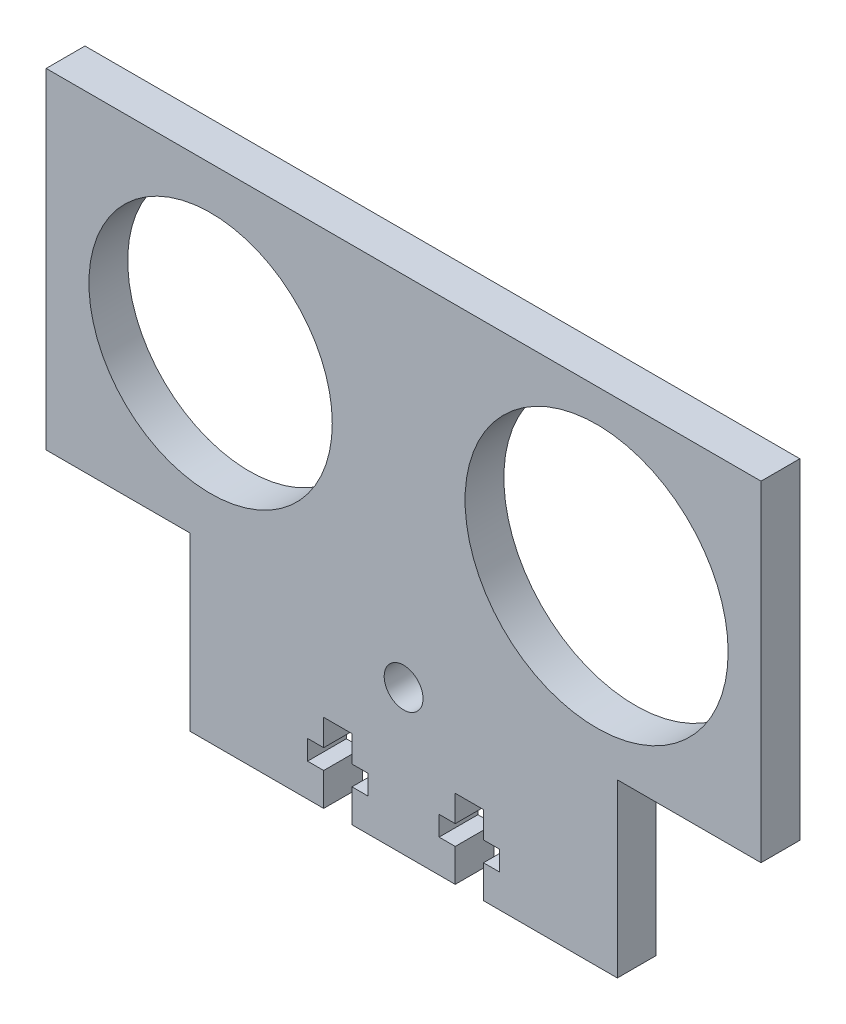
from build123d import *

# Parameters (mm, degrees)
SKETCH1_R           = 2.95
SKETCH1_R_2         = 20
SKETCH1_R_3         = 18.5
BOSS_EXTRUDE1_DEPTH = 5.9
CUT_EXTRUDE2_DEPTH  = 78.081470808


with BuildPart() as part:
    # Sketch1 → Boss-Extrude1 (new body)
    with BuildSketch(Plane.XY):
        Polygon((-32.5, 4.1), (-32.5, -22), (32.5, -22), (32.5, 4.1), (54.344931419, 4.1), (54.344931419, 54.344931419), (-54.344931419, 54.344931419), (-54.344931419, 4.1), align=None)
        Circle(SKETCH1_R, mode=Mode.SUBTRACT)
        with Locations((29.344931419, 29.344931419)):
            Circle(SKETCH1_R_2, mode=Mode.SUBTRACT)
        with Locations((-29.344931419, 29.344931419)):
            Circle(SKETCH1_R_3, mode=Mode.SUBTRACT)
    extrude(amount=BOSS_EXTRUDE1_DEPTH)

    # Sketch3 → Cut-Extrude2 (cut, through all)
    with BuildSketch(Plane.XY.offset(5.9)):
        Polygon((-12.15, -22), (-7.85, -22), (-7.85, -17), (-5.4, -17), (-5.4, -14), (-7.85, -14), (-7.85, -10), (-12.15, -10), (-12.15, -14), (-14.6, -14), (-14.6, -17), (-12.15, -17), align=None)
        Polygon((7.85, -14), (7.85, -10), (12.15, -10), (12.15, -14), (14.6, -14), (14.6, -17), (12.15, -17), (12.15, -22), (7.85, -22), (7.85, -17), (5.4, -17), (5.4, -14), align=None)
    extrude(amount=-CUT_EXTRUDE2_DEPTH, mode=Mode.SUBTRACT)


solid = part.part
